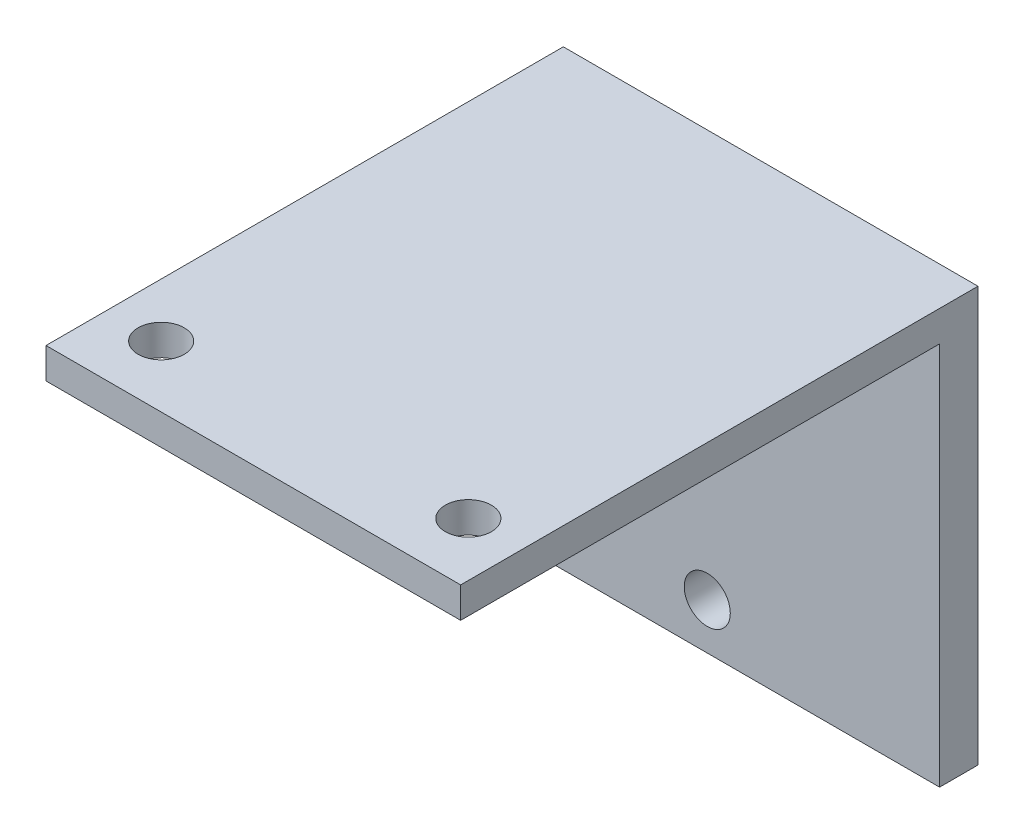
from build123d import *

# Parameters (mm, degrees)
ESQUISSE1_W             = 18
ESQUISSE1_H             = 54
ESQUISSE1_R             = 3
BOSS_EXTRU_1_DEPTH      = 67.37
ESQUISSE2_W             = 85.887974464
ESQUISSE2_H             = 58.790343592
ENL_V_MAT_EXTRU_1_DEPTH = 62.37
ESQUISSE3_R             = 3
ENL_V_MAT_EXTRU_2_DEPTH = 62.37


with BuildPart() as part:
    # Esquisse1 → Boss.-Extru.1 (new body)
    # profile 1 of 3: a face of its own
    with BuildSketch(Plane.XY):
        with Locations((18, 0)):
            Rectangle(ESQUISSE1_W, ESQUISSE1_H)
    # profile 2 of 3: a face of its own
    with BuildSketch(Plane.XY):
        with Locations((-18, 0)):
            Rectangle(ESQUISSE1_W, ESQUISSE1_H)
    # profile 3 of 3: a face of its own
    with BuildSketch(Plane.XY):
        Rectangle(ESQUISSE1_W, ESQUISSE1_H)
        with Locations((-3.258099324, -21)):
            Circle(ESQUISSE1_R, mode=Mode.SUBTRACT)
        with Locations((-3.258099324, 19)):
            Circle(ESQUISSE1_R, mode=Mode.SUBTRACT)
    extrude(amount=BOSS_EXTRU_1_DEPTH)

    # Esquisse2 → Enlèv. mat.-Extru.1 (cut)
    with BuildSketch(Plane.XY.offset(67.37)):
        with Locations((-4.168944697, -6.395171796)):
            Rectangle(ESQUISSE2_W, ESQUISSE2_H)
    extrude(amount=-ENL_V_MAT_EXTRU_1_DEPTH, mode=Mode.SUBTRACT)

    # Esquisse3 → Enlèv. mat.-Extru.2 (cut)
    with BuildSketch(Plane.XZ.offset(-23)):
        with Locations(Location((-20, 59.37, 0), (0, 0, 270))):
            Circle(ESQUISSE3_R)
        with Locations(Location((20, 59.37, 0), (0, 0, 270))):
            Circle(ESQUISSE3_R)
    extrude(amount=-ENL_V_MAT_EXTRU_2_DEPTH, mode=Mode.SUBTRACT)


solid = part.part
